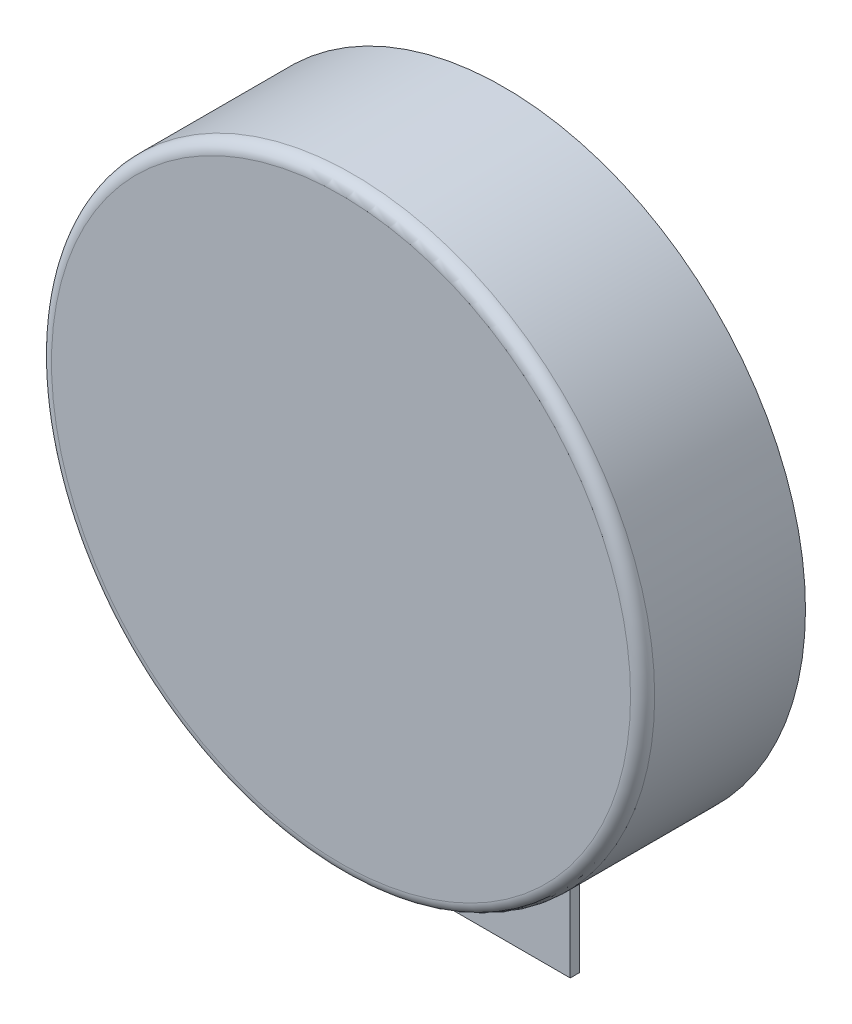
from build123d import *

# Parameters (mm, degrees)
SKETCH1_R           = 5
BOSS_EXTRUDE1_DEPTH = 2.7
BOSS_EXTRUDE2_DEPTH = 0.15
FILLET2_R           = 0.2


with BuildPart() as part:
    # Sketch1 → Boss-Extrude1 (new body)
    with BuildSketch(Plane.XY):
        Circle(SKETCH1_R)
    extrude(amount=BOSS_EXTRUDE1_DEPTH)

    # Sketch3 → Boss-Extrude2 (add)
    with BuildSketch(Plane(origin=(0, 0, 0), x_dir=(-1, 0, 0), z_dir=(0, 0, -1))):
        Polygon((1.25, -4.841229183), (1.25, -7.091229183), (-1.25, -7.091229183), (-1.25, -4.841229183), (-1.25, -4.179733262), (1.25, -4.179733262), align=None)
    extrude(amount=-BOSS_EXTRUDE2_DEPTH)

    # Fillet2
    fillet2_edges = [part.edges().sort_by_distance(p)[0] for p in [
        (-5, 0, 2.7),
    ]]
    fillet(fillet2_edges, radius=FILLET2_R)


solid = part.part
